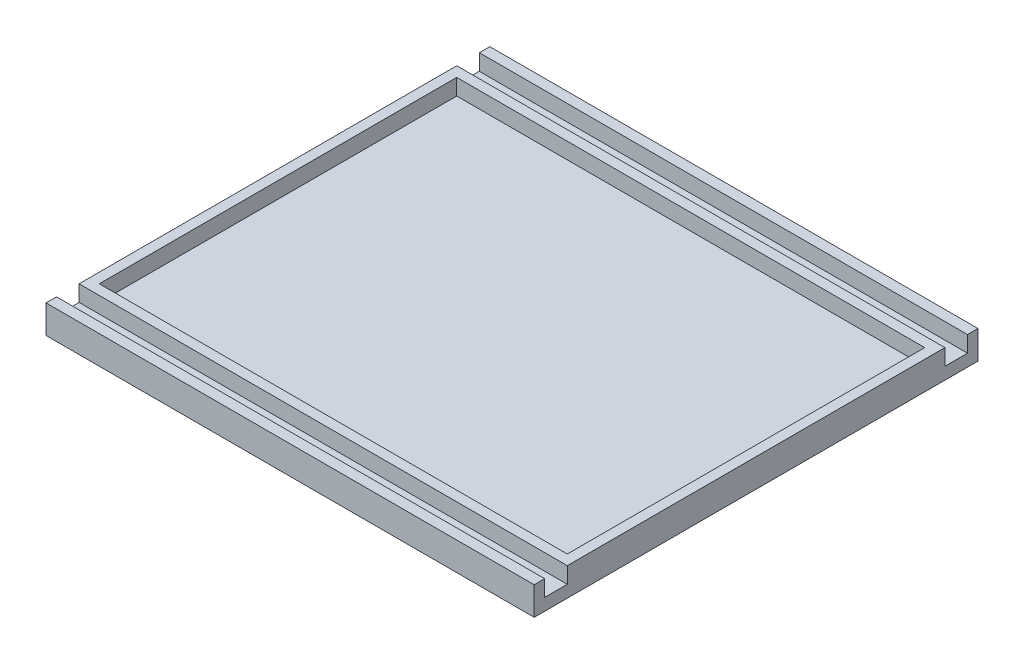
from build123d import *

# Parameters (mm, degrees)
SKETCH1_W           = 60.5
SKETCH1_H           = 55
BOSS_EXTRUDE1_DEPTH = 1.5
SKETCH2_W           = 60.5
SKETCH2_H           = 46.8
SKETCH2_W_2         = 58
SKETCH2_H_2         = 44.3
BOSS_EXTRUDE2_DEPTH = 2
SKETCH3_W           = 60.5
SKETCH3_H           = 1.3
BOSS_EXTRUDE3_DEPTH = 2


with BuildPart() as part:
    # Sketch1 → Boss-Extrude1 (new body)
    with BuildSketch(Plane(origin=(0, 0, 0), x_dir=(1, 0, 0), z_dir=(0, 1, 0))):
        Rectangle(SKETCH1_W, SKETCH1_H)
    extrude(amount=BOSS_EXTRUDE1_DEPTH)

    # Sketch2 → Boss-Extrude2 (add)
    with BuildSketch(Plane(origin=(0, 1.5, 0), x_dir=(1, 0, 0), z_dir=(0, 1, 0))):
        Rectangle(SKETCH2_W, SKETCH2_H)
        Rectangle(SKETCH2_W_2, SKETCH2_H_2, mode=Mode.SUBTRACT)
    extrude(amount=BOSS_EXTRUDE2_DEPTH)

    # Sketch3 → Boss-Extrude3 (add)
    with BuildSketch(Plane(origin=(0, 1.5, 0), x_dir=(1, 0, 0), z_dir=(0, 1, 0))):
        with Locations((0, 26.85)):
            Rectangle(SKETCH3_W, SKETCH3_H)
        with Locations((0, -26.85)):
            Rectangle(SKETCH3_W, SKETCH3_H)
    extrude(amount=BOSS_EXTRUDE3_DEPTH)


solid = part.part
